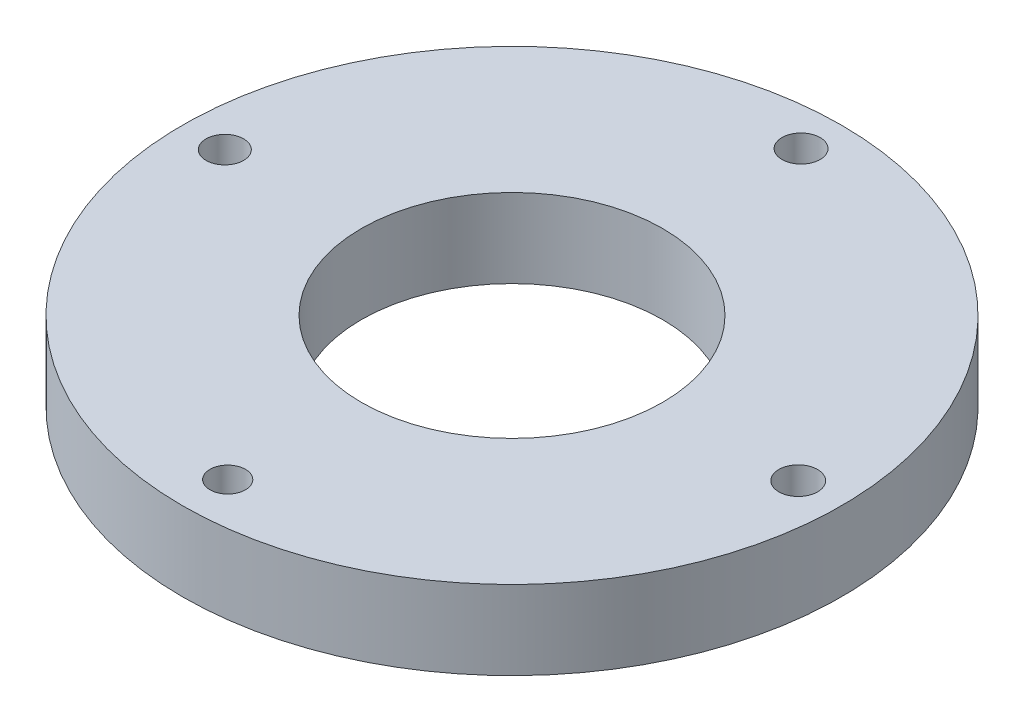
from build123d import *

# Parameters (mm, degrees)
SKETCH1_R           = 25.05
BOSS_EXTRUDE1_DEPTH = 6
SKETCH5_R           = 1.475
SKETCH5_R_2         = 1.45
SKETCH5_R_3         = 1.425
SKETCH5_R_4         = 1.35
SKETCH5_R_5         = 11.45
CUT_EXTRUDE2_DEPTH  = 36.930558025


with BuildPart() as part:
    # Sketch1 → Boss-Extrude1 (new body)
    with BuildSketch(Plane(origin=(0, 0, 0), x_dir=(1, 0, 0), z_dir=(0, 1, 0))):
        with Locations(Location((0, 0, 0), (0, 0, 270))):
            Circle(SKETCH1_R)
    extrude(amount=BOSS_EXTRUDE1_DEPTH)

    # Sketch5 → Cut-Extrude2 (cut, through all)
    with BuildSketch(Plane(origin=(0, 6, 0), x_dir=(1, 0, 0), z_dir=(0, 1, 0))):
        with Locations(Location((21.754981043, 0, 0), (0, 0, 270))):
            Circle(SKETCH5_R)
        with Locations(Location((0, 21.973258444, 0), (0, 0, 270))):
            Circle(SKETCH5_R_2)
        with Locations(Location((-21.827740177, 0, 0), (0, 0, 270))):
            Circle(SKETCH5_R_3)
        with Locations(Location((0, -21.609462775, 0), (0, 0, 270))):
            Circle(SKETCH5_R_4)
        with Locations(Location((0, 0, 0), (0, 0, 270))):
            Circle(SKETCH5_R_5)
    extrude(amount=-CUT_EXTRUDE2_DEPTH, mode=Mode.SUBTRACT)


solid = part.part
